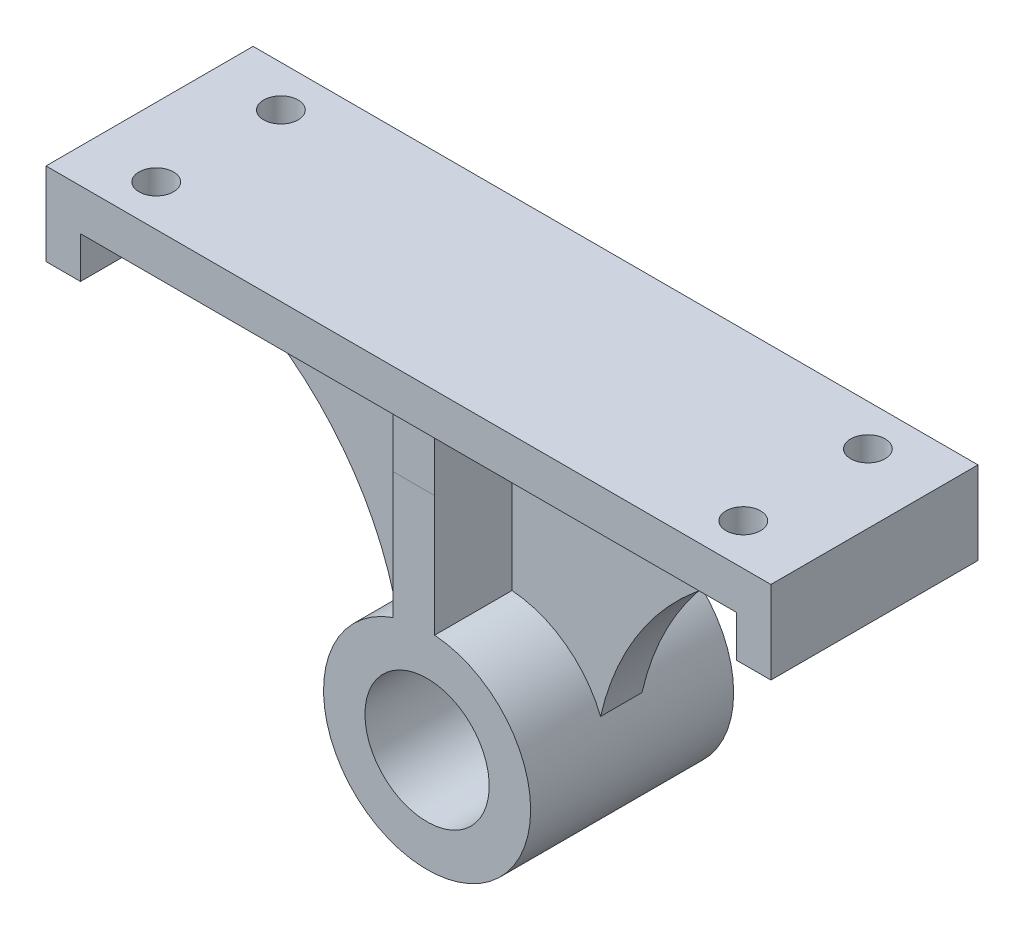
from build123d import *

# Parameters (mm, degrees)
BOSS_EXTRUDE1_DEPTH  = 152.4
SKETCH3_R            = 12.7
CUT_EXTRUDE1_DEPTH   = 40.64
SKETCH4_W            = 365.76
SKETCH4_H            = 30.48
BOSS_EXTRUDE2_DEPTH  = 40.64
BOSS_EXTRUDE7_DEPTH  = 30.48
SKETCH5_16_R         = 45.72
BOSS_EXTRUDE9_DEPTH  = 92.456
SKETCH9_W            = 206.074408616
SKETCH9_H            = 47.358127706
CUT_EXTRUDE3_DEPTH   = 256.032
SKETCH10_W           = 30.34917866
SKETCH10_H           = 40.64
BOSS_EXTRUDE10_DEPTH = 61.976
SKETCH11_W           = 30.48
SKETCH11_H           = 40.64
BOSS_EXTRUDE11_DEPTH = 56.934608


with BuildPart() as part:
    # Sketch1 → Boss-Extrude1 (new body)
    with BuildSketch(Plane.XY):
        Polygon((266.7, 15.24), (-266.7, 15.24), (-266.7, -15.24), (-266.7, -45.72), (-241.3, -45.72), (-241.3, -15.24), (241.3, -15.24), (241.3, -45.72), (266.7, -45.72), (266.7, -15.24), align=None)
    extrude(amount=-BOSS_EXTRUDE1_DEPTH)

    # Sketch3 → Cut-Extrude1 (cut)
    with BuildSketch(Plane(origin=(0, 15.24, 0), x_dir=(1, 0, 0), z_dir=(0, 1, 0))):
        with Locations((-215.972235605, 122.105743834)):
            Circle(SKETCH3_R)
        with Locations((-215.972235605, 30.414369603)):
            Circle(SKETCH3_R)
        with Locations((215.972235605, 30.414369603)):
            Circle(SKETCH3_R)
        with Locations((215.972235605, 122.105743834)):
            Circle(SKETCH3_R)
    extrude(amount=-CUT_EXTRUDE1_DEPTH, mode=Mode.SUBTRACT)

    # Sketch4 → Boss-Extrude2 (add)
    with BuildSketch(Plane.XZ.offset(15.24)):
        with Locations((0, -76.2)):
            Rectangle(SKETCH4_W, SKETCH4_H)
    extrude(amount=BOSS_EXTRUDE2_DEPTH)

    # Sketch5 → Boss-Extrude7 (add)
    with BuildSketch(Plane.XY.offset(-60.96)):
        with BuildLine():
            Line((-15.24, -148.839934257), (-15.24, -55.88))
            Line((-15.24, -55.88), (-182.88, -55.88))
            ThreePointArc((-182.88, -55.88), (-104.636686401, -122.326673794), (-66.442758058, -217.60731411))
            ThreePointArc((-66.442758058, -217.60731411), (-51.430319931, -175.339319441), (-15.24, -148.839934257))
        make_face()
        with BuildLine():
            Line((182.88, -55.88), (15.24, -55.88))
            Line((15.24, -55.88), (15.24, -144.84950765))
            ThreePointArc((15.24, -144.84950765), (54.663389815, -159.335335359), (80.423000783, -192.508898804))
            ThreePointArc((80.423000783, -192.508898804), (117.142790659, -113.314475438), (182.88, -55.88))
        make_face()
    extrude(amount=-BOSS_EXTRUDE7_DEPTH)

    # Sketch5<16> → Boss-Extrude9 (add, symmetric)
    with BuildSketch(Plane.XY.offset(-60.96)):
        with BuildLine():
            Line((-15.24, -55.88), (15.24, -55.88))
            Line((15.24, -55.88), (15.24, -144.84950765))
            ThreePointArc((15.24, -144.84950765), (19.579997786, -296.402247336), (-15.24, -148.839934257))
            Line((-15.24, -148.839934257), (-15.24, -55.88))
        make_face()
        with Locations((9.688342188, -220.847001658)):
            Circle(SKETCH5_16_R, mode=Mode.SUBTRACT)
    extrude(amount=BOSS_EXTRUDE9_DEPTH, both=True)

    # Sketch9 → Cut-Extrude3 (cut)
    with BuildSketch(Plane(origin=(0, -55.88, 0), x_dir=(1, 0, 0), z_dir=(0, 1, 0))):
        with Locations((3.259772677, -19.655003422)):
            Rectangle(SKETCH9_W, SKETCH9_H)
    extrude(amount=-CUT_EXTRUDE3_DEPTH, mode=Mode.SUBTRACT)

    # Sketch10 → Boss-Extrude10 (add)
    with BuildSketch(Plane(origin=(0, 0, -91.44), x_dir=(-1, 0, 0), z_dir=(0, 0, -1))):
        with Locations((0, -35.56)):
            Rectangle(SKETCH10_W, SKETCH10_H)
    extrude(amount=BOSS_EXTRUDE10_DEPTH)

    # Sketch11 → Boss-Extrude11 (add)
    with BuildSketch(Plane.XY.offset(-60.96)):
        with Locations((0, -35.56)):
            Rectangle(SKETCH11_W, SKETCH11_H)
    extrude(amount=BOSS_EXTRUDE11_DEPTH)


solid = part.part
